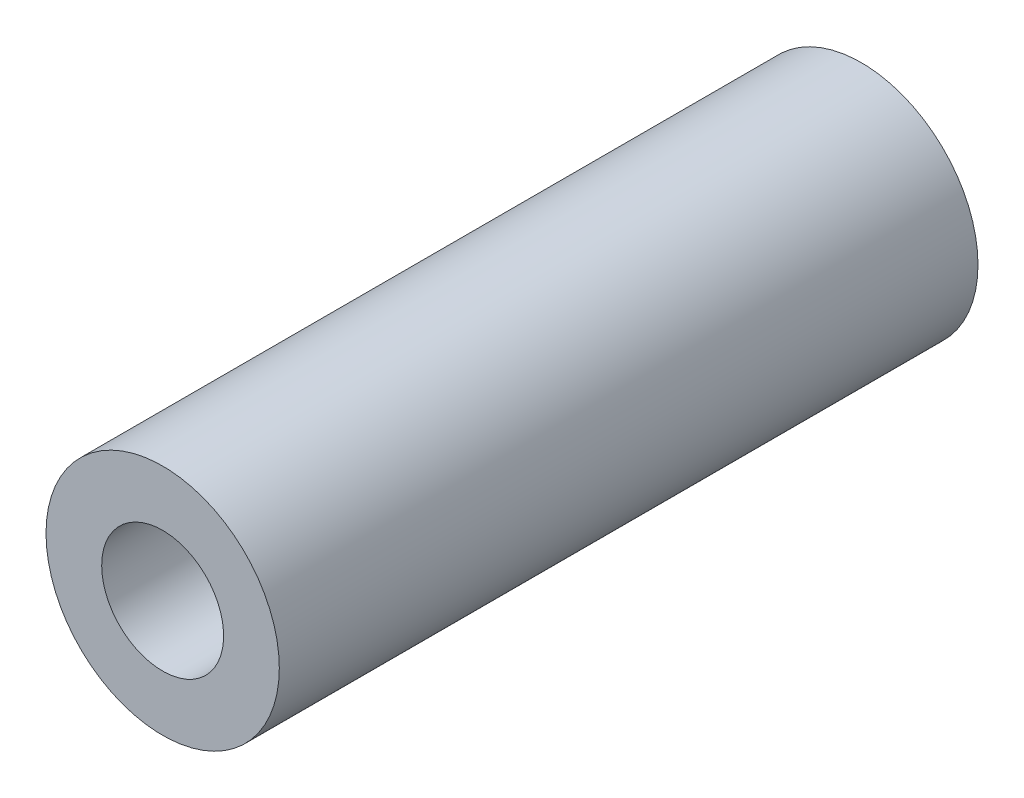
from build123d import *

# Parameters (mm, degrees)
SKETCH1_R           = 4.7625
SKETCH1_R_2         = 2.4892
BOSS_EXTRUDE1_DEPTH = 14.2621


with BuildPart() as part:
    # Sketch1 → Boss-Extrude1 (new, symmetric)
    with BuildSketch(Plane.XY):
        with Locations(Location((0, 0, 0), (0, 0, 180))):
            Circle(SKETCH1_R)
        with Locations(Location((0, 0, 0), (0, 0, 180))):
            Circle(SKETCH1_R_2, mode=Mode.SUBTRACT)
    extrude(amount=BOSS_EXTRUDE1_DEPTH, both=True)


solid = part.part
